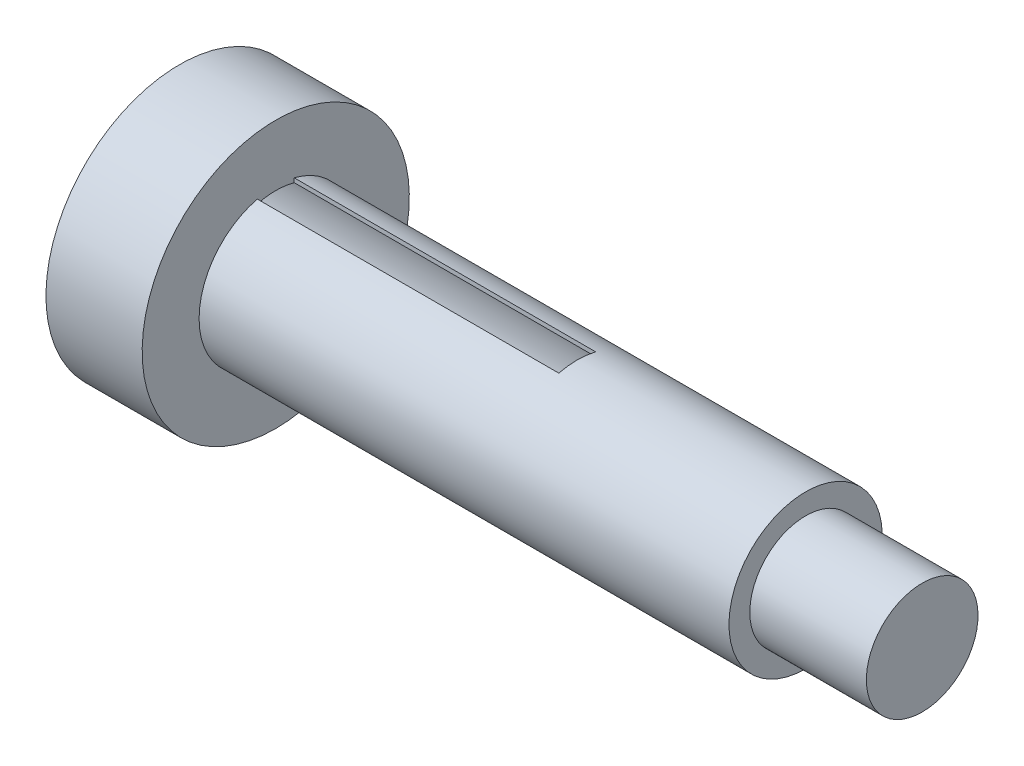
from build123d import *

# Parameters (mm, degrees)
CUT_EXTRUDE2_DEPTH      = 198.226946435
CUT_EXTRUDE2_DEPTH_BACK = 198.226946435
SKETCH3_W               = 77.6
SKETCH3_H               = 9.49


with BuildPart() as part:
    # Sketch1 → Revolve2 (revolve)
    with BuildSketch(Plane.XY, mode=Mode.PRIVATE) as revolve2_sk:
        Polygon((191.14, 0), (191.14, 14.37), (161.14, 14.37), (161.14, 19.73), (24.76, 19.73), (24.76, 34.38), (0, 34.38), (0, 18.68), (142.46, 18.68), (142.46, 0), align=None)
    revolve(revolve2_sk.sketch.rotate(Axis((0, 0, 0), (1, 0, 0)), 180), axis=Axis((0, 0, 0), (1, 0, 0)))

    # Sketch3 → Cut-Extrude2 (cut, two sides: drawn at the far end of the back side and taken through both)
    with BuildSketch(Plane(origin=(0, 0, 0), x_dir=(1, 0, 0), z_dir=(0, 1, 0)).offset(-CUT_EXTRUDE2_DEPTH_BACK)):
        with Locations((63.56, 0)):
            Rectangle(SKETCH3_W, SKETCH3_H)
    extrude(amount=CUT_EXTRUDE2_DEPTH + CUT_EXTRUDE2_DEPTH_BACK, mode=Mode.SUBTRACT)


solid = part.part
